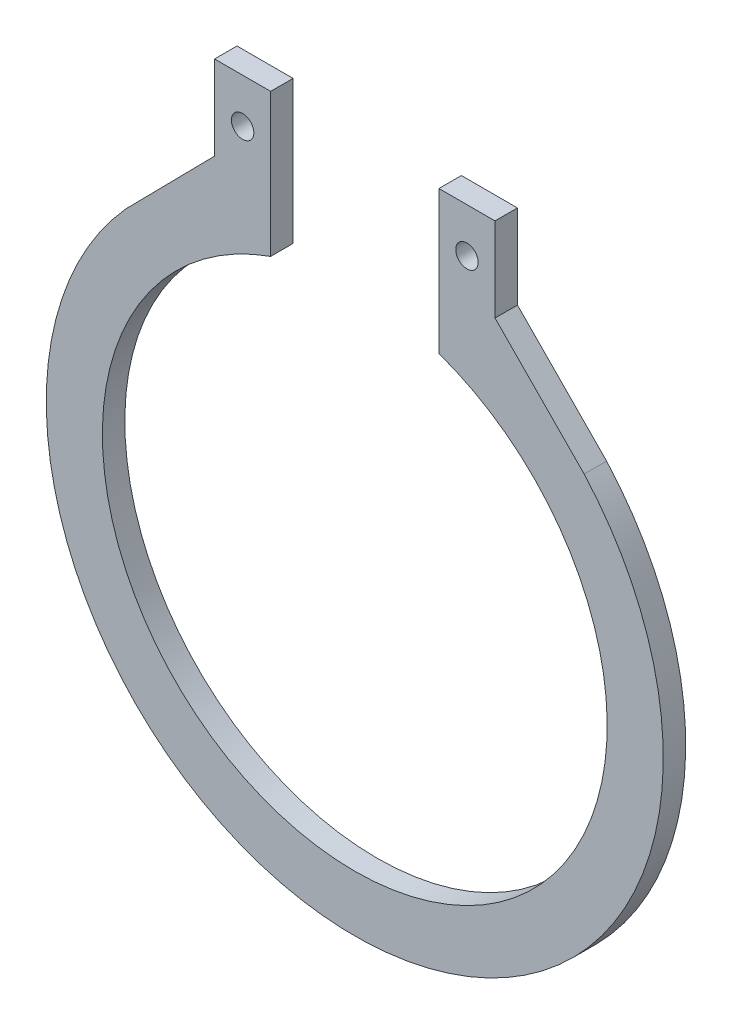
from build123d import *

# Parameters (mm, degrees)
SKETCH1_R      = 1
EXTRUDE1_DEPTH = 2


with BuildPart() as part:
    # Sketch1 → Extrude1 (new body)
    with BuildSketch(Plane.XY):
        with BuildLine():
            Line((-12.5, 33.957513111), (-12.5, 26.457513111))
            Line((-12.5, 26.457513111), (-18.696787712, 20.166311741))
            Line((-18.696787712, 20.166311741), (-20.446699126, 18.389738847))
            ThreePointArc((-20.446699126, 18.389738847), (0, -27.5), (20.446699126, 18.389738847))
            Line((20.446699126, 18.389738847), (18.696787712, 20.166311741))
            Line((18.696787712, 20.166311741), (12.5, 26.457513111))
            Line((12.5, 26.457513111), (12.5, 33.957513111))
            Line((12.5, 33.957513111), (7.5, 33.957513111))
            Line((7.5, 33.957513111), (7.5, 21.213203436))
            ThreePointArc((7.5, 21.213203436), (0, -22.5), (-7.5, 21.213203436))
            Line((-7.5, 21.213203436), (-7.5, 33.957513111))
            Line((-7.5, 33.957513111), (-12.5, 33.957513111))
        make_face()
        with Locations(Location((-10, 30, 0), (0, 0, 180))):
            Circle(SKETCH1_R, mode=Mode.SUBTRACT)
        with Locations(Location((10, 30, 0), (0, 0, 180))):
            Circle(SKETCH1_R, mode=Mode.SUBTRACT)
    extrude(amount=EXTRUDE1_DEPTH)


solid = part.part
